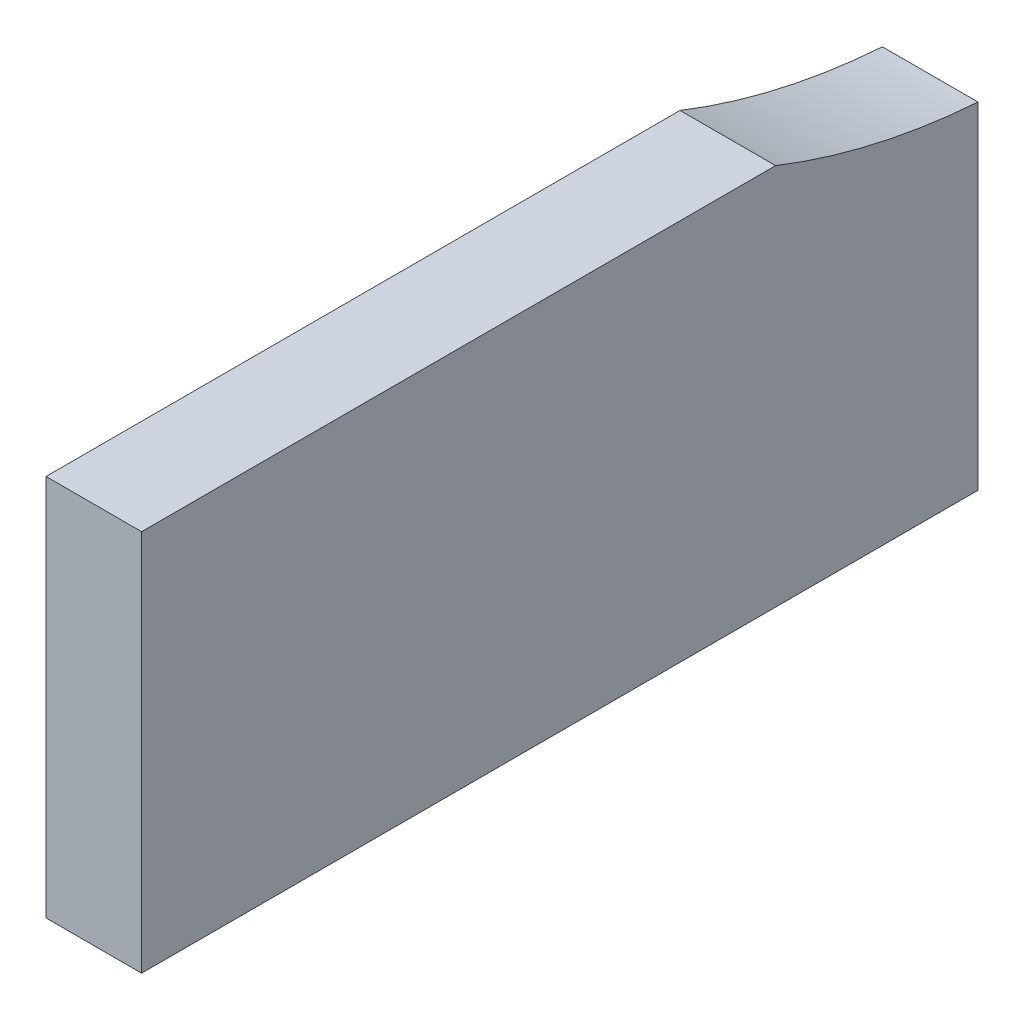
from build123d import *

# Parameters (mm, degrees)
SKETCH1_W               = 5
SKETCH1_H               = 20
BOSS_EXTRUDE1_DEPTH     = 88.5
CUT_EXTRUDE2_DEPTH      = 35
CUT_EXTRUDE2_DEPTH_BACK = 35
SKETCH5_R               = 35.5
SKETCH2_W               = 5
SKETCH2_H               = 20
CUT_EXTRUDE3_DEPTH      = 13
SKETCH8_W               = 39.75
SKETCH8_H               = 20
CUT_EXTRUDE4_DEPTH      = 13


with BuildPart() as part:
    # Sketch1 → Boss-Extrude1 (new body)
    with BuildSketch(Plane.XY):
        with Locations((-2.5, 10)):
            Rectangle(SKETCH1_W, SKETCH1_H)
    extrude(amount=BOSS_EXTRUDE1_DEPTH)

    # Sketch5 → Cut-Extrude2 (cut, two sides: drawn at the far end of the back side and taken through both)
    with BuildSketch(Plane(origin=(0, 0, 0), x_dir=(0, 0, -1), z_dir=(1, 0, 0)).offset(-CUT_EXTRUDE2_DEPTH_BACK)):
        with Locations((-42.25, 53)):
            Circle(SKETCH5_R)
    extrude(amount=CUT_EXTRUDE2_DEPTH + CUT_EXTRUDE2_DEPTH_BACK, mode=Mode.SUBTRACT)

    # Sketch2 → Cut-Extrude3 (cut)
    with BuildSketch(Plane.ZY.offset(5)):
        with Locations((42.25, 10)):
            Rectangle(SKETCH2_W, SKETCH2_H)
    extrude(amount=-CUT_EXTRUDE3_DEPTH, mode=Mode.SUBTRACT)


with BuildPart() as cut_extrude3_piece_1:
    # of the separate pieces the step leaves, piece 1, a body of its own (cut_extrude3_pieces)
    add(part.part.solids().sort_by_distance((0, 0, 44.75))[0])


with BuildPart() as cut_extrude3_piece_2:
    # of the separate pieces the step leaves, piece 2, a body of its own (cut_extrude3_pieces)
    add(part.part.solids().sort_by_distance((-5, 20, 0))[0])

    # Sketch8 → Cut-Extrude4 (cut)
    with BuildSketch(Plane.ZY.offset(5)):
        with Locations((19.875, 10)):
            Rectangle(SKETCH8_W, SKETCH8_H)
    extrude(amount=-CUT_EXTRUDE4_DEPTH, mode=Mode.SUBTRACT)


solid = cut_extrude3_piece_1.part
